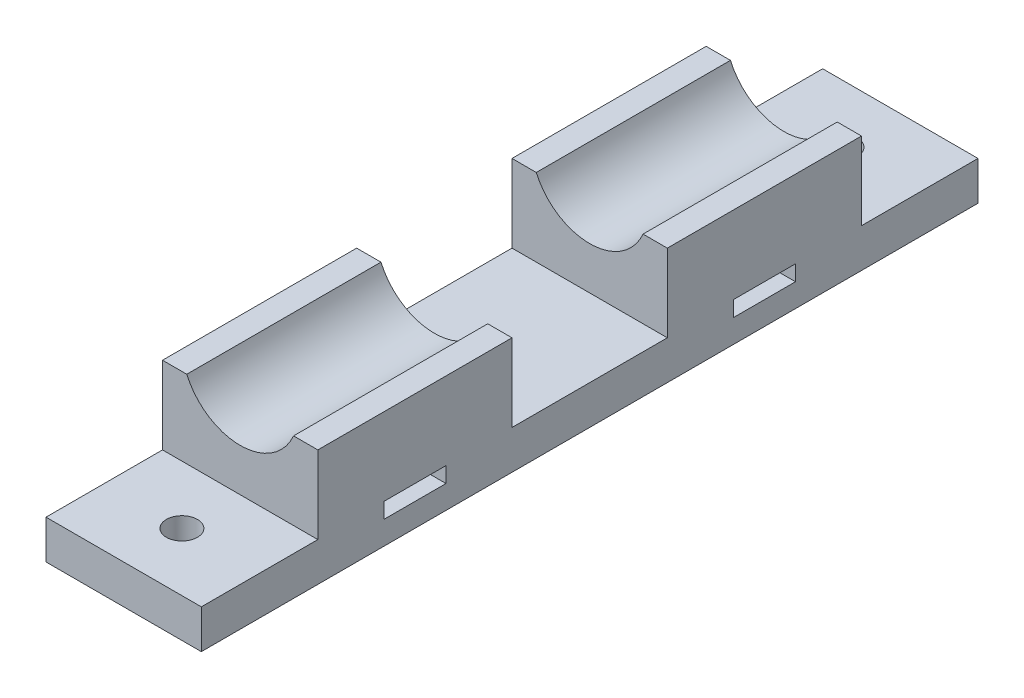
from build123d import *

# Parameters (mm, degrees)
ESBO_O1_W                = 8
ESBO_O1_H                = 2
RESSALTO_EXTRUS_O1_DEPTH = 10
CORTE_EXTRUS_O1_REACH    = 74.966
ESBO_O4_W                = 20
ESBO_O4_H                = 15
ESBO_O4_R                = 2
RESSALTO_EXTRUS_O2_DEPTH = 5


with BuildPart() as part:
    # Esboço1 → Ressalto-extrusão1 (new, symmetric)
    with BuildSketch(Plane(origin=(0, 0, 0), x_dir=(0, 0, -1), z_dir=(1, 0, 0))):
        Polygon((-35, 18), (-10, 18), (-10, 5), (10, 5), (10, 18), (35, 18), (35, 0), (-35, 0), align=None)
        with Locations((-22.5, 4)):
            Rectangle(ESBO_O1_W, ESBO_O1_H, mode=Mode.SUBTRACT)
        with Locations((22.5, 4)):
            Rectangle(ESBO_O1_W, ESBO_O1_H, mode=Mode.SUBTRACT)
    extrude(amount=RESSALTO_EXTRUS_O1_DEPTH, both=True)

    # Corte-extrusão1: up to this face of the body (flat: up to its plane)
    corte_extrus_o1_end = Plane(part.part.faces().sort_by_distance((0, 9, -35))[0])
    # Esboço2 → Corte-extrusão1 (cut, up to the picked face)
    with BuildSketch(Plane.XY.offset(35), mode=Mode.PRIVATE) as corte_extrus_o1_sk1:
        with BuildLine():
            Line((-10, 15), (-6.873863542, 15))
            ThreePointArc((-6.873863542, 15), (0, 10.5), (6.873863542, 15))
            Line((6.873863542, 15), (10, 15))
            Line((10, 15), (10, 18))
            Line((10, 18), (7.5, 18))
            Line((7.5, 18), (-7.5, 18))
            Line((-7.5, 18), (-10, 18))
            Line((-10, 18), (-10, 15))
        make_face()
    corte_extrus_o1_tool1 = split(extrude(corte_extrus_o1_sk1.sketch, amount=-CORTE_EXTRUS_O1_REACH, mode=Mode.PRIVATE), bisect_by=corte_extrus_o1_end, keep=Keep.BOTH, mode=Mode.PRIVATE)
    add(corte_extrus_o1_tool1.solids().sort_by(Axis((0, 15.069195, 35), (0, 0, -1)))[0], mode=Mode.SUBTRACT)

    # Esboço4 → Ressalto-extrusão2 (add)
    # profile 1 of 2: a face of its own
    with BuildSketch(Plane(origin=(0, 5, 0), x_dir=(1, 0, 0), z_dir=(0, 1, 0))):
        with Locations((0, 42.5)):
            Rectangle(ESBO_O4_W, ESBO_O4_H)
        with Locations(Location((0, 42.5, 0), (0, 0, 270))):
            Circle(ESBO_O4_R, mode=Mode.SUBTRACT)
    # profile 2 of 2: a face of its own
    with BuildSketch(Plane(origin=(0, 5, 0), x_dir=(1, 0, 0), z_dir=(0, 1, 0))):
        with Locations((0, -42.5)):
            Rectangle(ESBO_O4_W, ESBO_O4_H)
        with Locations(Location((0, -42.5, 0), (0, 0, 270))):
            Circle(ESBO_O4_R, mode=Mode.SUBTRACT)
    extrude(amount=-RESSALTO_EXTRUS_O2_DEPTH)


solid = part.part
